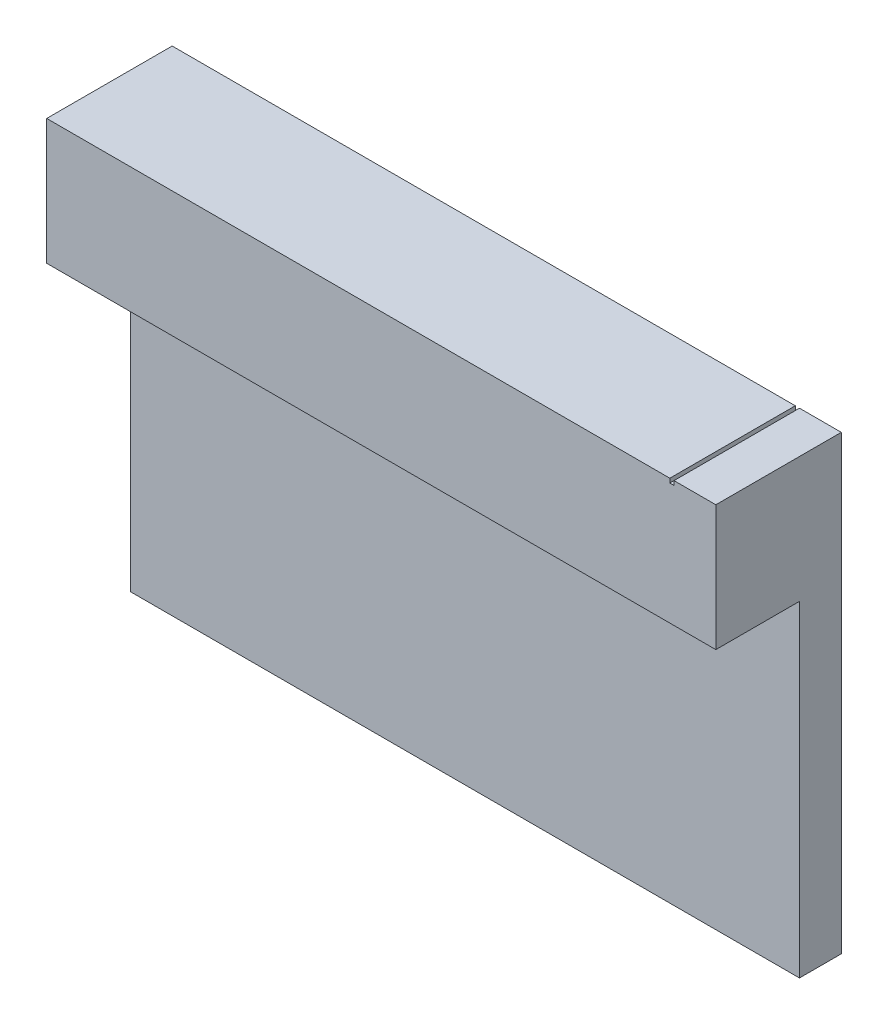
from build123d import *

# Parameters (mm, degrees)
ESQUISSE1_W             = 160
ESQUISSE1_H             = 108
BOSS_EXTRU_1_DEPTH      = 10
ESQUISSE2_W             = 160
ESQUISSE2_H             = 30
BOSS_EXTRU_2_DEPTH      = 20
ESQUISSE3_W             = 1
ESQUISSE3_H             = 30
ENL_V_MAT_EXTRU_1_DEPTH = 1


with BuildPart() as part:
    # Esquisse1 → Boss.-Extru.1 (new body)
    with BuildSketch(Plane.XY):
        with Locations((27.187647666, -32.051659751)):
            Rectangle(ESQUISSE1_W, ESQUISSE1_H)
    extrude(amount=BOSS_EXTRU_1_DEPTH)

    # Esquisse2 → Boss.-Extru.2 (add)
    with BuildSketch(Plane.XY.offset(10)):
        with Locations((27.187647666, 6.948340249)):
            Rectangle(ESQUISSE2_W, ESQUISSE2_H)
    extrude(amount=BOSS_EXTRU_2_DEPTH)

    # Esquisse3 → Enlèv. mat.-Extru.1 (cut)
    with BuildSketch(Plane(origin=(0, 21.948340249, 0), x_dir=(1, 0, 0), z_dir=(0, 1, 0))):
        with Locations((96.687647666, -15)):
            Rectangle(ESQUISSE3_W, ESQUISSE3_H)
    extrude(amount=-ENL_V_MAT_EXTRU_1_DEPTH, mode=Mode.SUBTRACT)


solid = part.part
